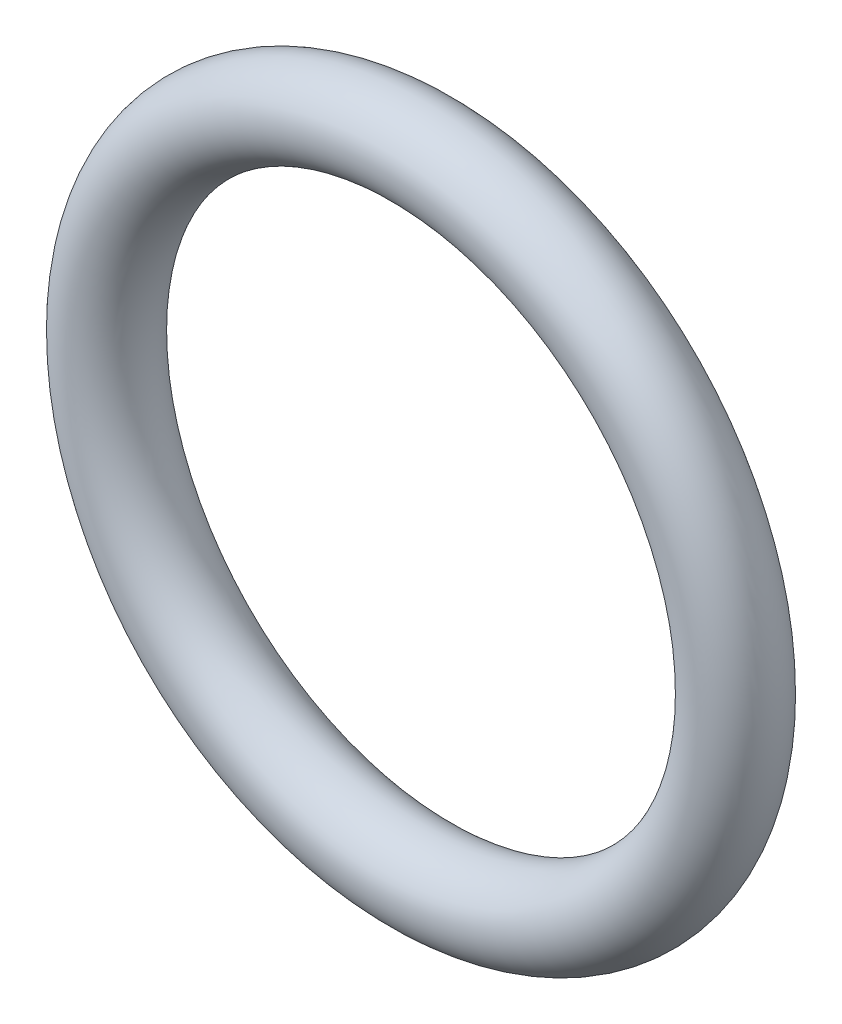
from build123d import *

# Parameters (mm, degrees)
SKETCH_1_R = 1.25


with BuildPart() as part:
    # Эскиз1 → Повернуть1 (revolve)
    with BuildSketch(Plane(origin=(0, 0, 0), x_dir=(1, 0, 0), z_dir=(0, 1, 0))):
        with Locations((9.25, 0)):
            Circle(SKETCH_1_R)
    revolve(axis=Axis((0, 0, 0), (0, 0, -1)))


solid = part.part
